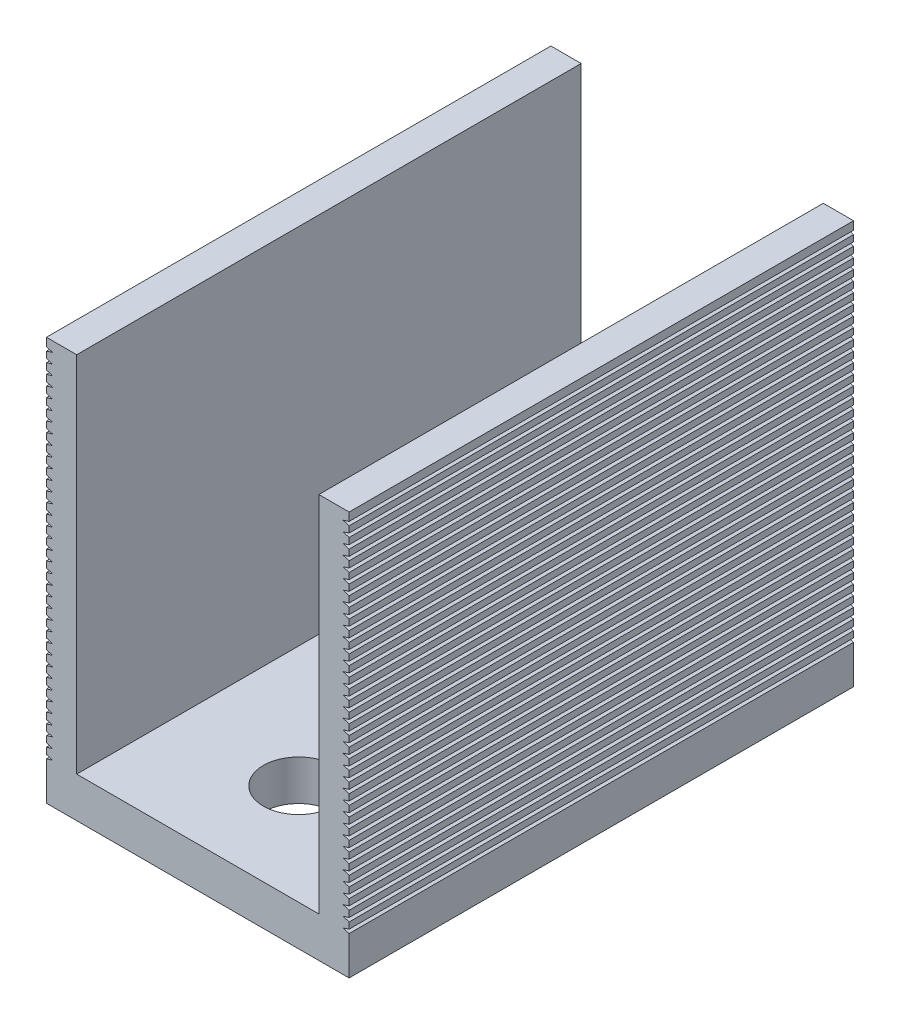
from build123d import *

# Parameters (mm, degrees)
BOSS_EXTRUDE1_DEPTH   = 25
SKETCH2_R             = 1.75
SKETCH2_W             = 12
SKETCH2_H             = 14.852283911
CUT_EXTRUDE1_DEPTH    = 25
CUT_EXTRUDE2_DEPTH    = 33.882366095
LPATTERN1_COUNT       = 36
LPATTERN1_PITCH       = 0.5
MIRROR1_COPY_1_DEPTH  = 33.882366095
MIRROR1_COPY_2_DEPTH  = 33.882366095
MIRROR1_COPY_3_DEPTH  = 33.882366095
MIRROR1_COPY_4_DEPTH  = 33.882366095
MIRROR1_COPY_5_DEPTH  = 33.882366095
MIRROR1_COPY_6_DEPTH  = 33.882366095
MIRROR1_COPY_7_DEPTH  = 33.882366095
MIRROR1_COPY_8_DEPTH  = 33.882366095
MIRROR1_COPY_9_DEPTH  = 33.882366095
MIRROR1_COPY_10_DEPTH = 33.882366095
MIRROR1_COPY_11_DEPTH = 33.882366095
MIRROR1_COPY_12_DEPTH = 33.882366095
MIRROR1_COPY_13_DEPTH = 33.882366095
MIRROR1_COPY_14_DEPTH = 33.882366095
MIRROR1_COPY_15_DEPTH = 33.882366095
MIRROR1_COPY_16_DEPTH = 33.882366095
MIRROR1_COPY_17_DEPTH = 33.882366095
MIRROR1_COPY_18_DEPTH = 33.882366095
MIRROR1_COPY_19_DEPTH = 33.882366095
MIRROR1_COPY_20_DEPTH = 33.882366095
MIRROR1_COPY_21_DEPTH = 33.882366095
MIRROR1_COPY_22_DEPTH = 33.882366095
MIRROR1_COPY_23_DEPTH = 33.882366095
MIRROR1_COPY_24_DEPTH = 33.882366095
MIRROR1_COPY_25_DEPTH = 33.882366095
MIRROR1_COPY_26_DEPTH = 33.882366095
MIRROR1_COPY_27_DEPTH = 33.882366095
MIRROR1_COPY_28_DEPTH = 33.882366095
MIRROR1_COPY_29_DEPTH = 33.882366095
MIRROR1_COPY_30_DEPTH = 33.882366095
MIRROR1_COPY_31_DEPTH = 33.882366095
MIRROR1_COPY_32_DEPTH = 33.882366095
MIRROR1_COPY_33_DEPTH = 33.882366095
MIRROR1_COPY_34_DEPTH = 33.882366095
MIRROR1_COPY_35_DEPTH = 33.882366095


with BuildPart() as part:
    # Sketch1 → Boss-Extrude1 (new body)
    with BuildSketch(Plane.XY):
        Polygon((-7.5, 20), (-7.5, 0), (7.5, 0), (7.5, 20), (6, 20), (6, 2), (-6, 2), (-6, 20), align=None)
    extrude(amount=BOSS_EXTRUDE1_DEPTH)

    # Sketch2 → Cut-Extrude1 (cut)
    with BuildSketch(Plane(origin=(0, 2, 0), x_dir=(1, 0, 0), z_dir=(0, 1, 0))):
        with Locations(Location((0, -20, 0), (0, 0, 180))):
            Circle(SKETCH2_R)
        with Locations((0, 1.426141956)):
            Rectangle(SKETCH2_W, SKETCH2_H)
    extrude(amount=-CUT_EXTRUDE1_DEPTH, mode=Mode.SUBTRACT)

    # Sketch3 → Cut-Extrude2 (cut, through all)
    with BuildSketch(Plane.XY.offset(25)):
        Polygon((-8, 19.75), (-7.2, 19.5), (-8, 19.25), align=None)
    cut_extrude2 = extrude(amount=-CUT_EXTRUDE2_DEPTH, mode=Mode.SUBTRACT)

    # LPattern1: Cut-Extrude2 ×36
    with Locations(*[(0, -i * LPATTERN1_PITCH, 0) for i in range(1, LPATTERN1_COUNT)]):
        add(cut_extrude2, mode=Mode.SUBTRACT)

    # Mirror1: Cut-Extrude2 across plane
    add(cut_extrude2.mirror(Plane(origin=(0, 0, 0), x_dir=(0, 0, 1), z_dir=(1, 0, 0))), mode=Mode.SUBTRACT)

    # Mirror1 copy 1 sketch → Mirror1 copy 1 (cut, through all)
    with BuildSketch(Plane(origin=(0, -0.5, 25), x_dir=(-1, 0, 0), z_dir=(0, 0, 1))):
        Polygon((-8, -19.75), (-7.2, -19.5), (-8, -19.25), align=None)
    extrude(amount=-MIRROR1_COPY_1_DEPTH, mode=Mode.SUBTRACT)

    # Mirror1 copy 2 sketch → Mirror1 copy 2 (cut, through all)
    with BuildSketch(Plane(origin=(0, -1, 25), x_dir=(-1, 0, 0), z_dir=(0, 0, 1))):
        Polygon((-8, -19.75), (-7.2, -19.5), (-8, -19.25), align=None)
    extrude(amount=-MIRROR1_COPY_2_DEPTH, mode=Mode.SUBTRACT)

    # Mirror1 copy 3 sketch → Mirror1 copy 3 (cut, through all)
    with BuildSketch(Plane(origin=(0, -1.5, 25), x_dir=(-1, 0, 0), z_dir=(0, 0, 1))):
        Polygon((-8, -19.75), (-7.2, -19.5), (-8, -19.25), align=None)
    extrude(amount=-MIRROR1_COPY_3_DEPTH, mode=Mode.SUBTRACT)

    # Mirror1 copy 4 sketch → Mirror1 copy 4 (cut, through all)
    with BuildSketch(Plane(origin=(0, -2, 25), x_dir=(-1, 0, 0), z_dir=(0, 0, 1))):
        Polygon((-8, -19.75), (-7.2, -19.5), (-8, -19.25), align=None)
    extrude(amount=-MIRROR1_COPY_4_DEPTH, mode=Mode.SUBTRACT)

    # Mirror1 copy 5 sketch → Mirror1 copy 5 (cut, through all)
    with BuildSketch(Plane(origin=(0, -2.5, 25), x_dir=(-1, 0, 0), z_dir=(0, 0, 1))):
        Polygon((-8, -19.75), (-7.2, -19.5), (-8, -19.25), align=None)
    extrude(amount=-MIRROR1_COPY_5_DEPTH, mode=Mode.SUBTRACT)

    # Mirror1 copy 6 sketch → Mirror1 copy 6 (cut, through all)
    with BuildSketch(Plane(origin=(0, -3, 25), x_dir=(-1, 0, 0), z_dir=(0, 0, 1))):
        Polygon((-8, -19.75), (-7.2, -19.5), (-8, -19.25), align=None)
    extrude(amount=-MIRROR1_COPY_6_DEPTH, mode=Mode.SUBTRACT)

    # Mirror1 copy 7 sketch → Mirror1 copy 7 (cut, through all)
    with BuildSketch(Plane(origin=(0, -3.5, 25), x_dir=(-1, 0, 0), z_dir=(0, 0, 1))):
        Polygon((-8, -19.75), (-7.2, -19.5), (-8, -19.25), align=None)
    extrude(amount=-MIRROR1_COPY_7_DEPTH, mode=Mode.SUBTRACT)

    # Mirror1 copy 8 sketch → Mirror1 copy 8 (cut, through all)
    with BuildSketch(Plane(origin=(0, -4, 25), x_dir=(-1, 0, 0), z_dir=(0, 0, 1))):
        Polygon((-8, -19.75), (-7.2, -19.5), (-8, -19.25), align=None)
    extrude(amount=-MIRROR1_COPY_8_DEPTH, mode=Mode.SUBTRACT)

    # Mirror1 copy 9 sketch → Mirror1 copy 9 (cut, through all)
    with BuildSketch(Plane(origin=(0, -4.5, 25), x_dir=(-1, 0, 0), z_dir=(0, 0, 1))):
        Polygon((-8, -19.75), (-7.2, -19.5), (-8, -19.25), align=None)
    extrude(amount=-MIRROR1_COPY_9_DEPTH, mode=Mode.SUBTRACT)

    # Mirror1 copy 10 sketch → Mirror1 copy 10 (cut, through all)
    with BuildSketch(Plane(origin=(0, -5, 25), x_dir=(-1, 0, 0), z_dir=(0, 0, 1))):
        Polygon((-8, -19.75), (-7.2, -19.5), (-8, -19.25), align=None)
    extrude(amount=-MIRROR1_COPY_10_DEPTH, mode=Mode.SUBTRACT)

    # Mirror1 copy 11 sketch → Mirror1 copy 11 (cut, through all)
    with BuildSketch(Plane(origin=(0, -5.5, 25), x_dir=(-1, 0, 0), z_dir=(0, 0, 1))):
        Polygon((-8, -19.75), (-7.2, -19.5), (-8, -19.25), align=None)
    extrude(amount=-MIRROR1_COPY_11_DEPTH, mode=Mode.SUBTRACT)

    # Mirror1 copy 12 sketch → Mirror1 copy 12 (cut, through all)
    with BuildSketch(Plane(origin=(0, -6, 25), x_dir=(-1, 0, 0), z_dir=(0, 0, 1))):
        Polygon((-8, -19.75), (-7.2, -19.5), (-8, -19.25), align=None)
    extrude(amount=-MIRROR1_COPY_12_DEPTH, mode=Mode.SUBTRACT)

    # Mirror1 copy 13 sketch → Mirror1 copy 13 (cut, through all)
    with BuildSketch(Plane(origin=(0, -6.5, 25), x_dir=(-1, 0, 0), z_dir=(0, 0, 1))):
        Polygon((-8, -19.75), (-7.2, -19.5), (-8, -19.25), align=None)
    extrude(amount=-MIRROR1_COPY_13_DEPTH, mode=Mode.SUBTRACT)

    # Mirror1 copy 14 sketch → Mirror1 copy 14 (cut, through all)
    with BuildSketch(Plane(origin=(0, -7, 25), x_dir=(-1, 0, 0), z_dir=(0, 0, 1))):
        Polygon((-8, -19.75), (-7.2, -19.5), (-8, -19.25), align=None)
    extrude(amount=-MIRROR1_COPY_14_DEPTH, mode=Mode.SUBTRACT)

    # Mirror1 copy 15 sketch → Mirror1 copy 15 (cut, through all)
    with BuildSketch(Plane(origin=(0, -7.5, 25), x_dir=(-1, 0, 0), z_dir=(0, 0, 1))):
        Polygon((-8, -19.75), (-7.2, -19.5), (-8, -19.25), align=None)
    extrude(amount=-MIRROR1_COPY_15_DEPTH, mode=Mode.SUBTRACT)

    # Mirror1 copy 16 sketch → Mirror1 copy 16 (cut, through all)
    with BuildSketch(Plane(origin=(0, -8, 25), x_dir=(-1, 0, 0), z_dir=(0, 0, 1))):
        Polygon((-8, -19.75), (-7.2, -19.5), (-8, -19.25), align=None)
    extrude(amount=-MIRROR1_COPY_16_DEPTH, mode=Mode.SUBTRACT)

    # Mirror1 copy 17 sketch → Mirror1 copy 17 (cut, through all)
    with BuildSketch(Plane(origin=(0, -8.5, 25), x_dir=(-1, 0, 0), z_dir=(0, 0, 1))):
        Polygon((-8, -19.75), (-7.2, -19.5), (-8, -19.25), align=None)
    extrude(amount=-MIRROR1_COPY_17_DEPTH, mode=Mode.SUBTRACT)

    # Mirror1 copy 18 sketch → Mirror1 copy 18 (cut, through all)
    with BuildSketch(Plane(origin=(0, -9, 25), x_dir=(-1, 0, 0), z_dir=(0, 0, 1))):
        Polygon((-8, -19.75), (-7.2, -19.5), (-8, -19.25), align=None)
    extrude(amount=-MIRROR1_COPY_18_DEPTH, mode=Mode.SUBTRACT)

    # Mirror1 copy 19 sketch → Mirror1 copy 19 (cut, through all)
    with BuildSketch(Plane(origin=(0, -9.5, 25), x_dir=(-1, 0, 0), z_dir=(0, 0, 1))):
        Polygon((-8, -19.75), (-7.2, -19.5), (-8, -19.25), align=None)
    extrude(amount=-MIRROR1_COPY_19_DEPTH, mode=Mode.SUBTRACT)

    # Mirror1 copy 20 sketch → Mirror1 copy 20 (cut, through all)
    with BuildSketch(Plane(origin=(0, -10, 25), x_dir=(-1, 0, 0), z_dir=(0, 0, 1))):
        Polygon((-8, -19.75), (-7.2, -19.5), (-8, -19.25), align=None)
    extrude(amount=-MIRROR1_COPY_20_DEPTH, mode=Mode.SUBTRACT)

    # Mirror1 copy 21 sketch → Mirror1 copy 21 (cut, through all)
    with BuildSketch(Plane(origin=(0, -10.5, 25), x_dir=(-1, 0, 0), z_dir=(0, 0, 1))):
        Polygon((-8, -19.75), (-7.2, -19.5), (-8, -19.25), align=None)
    extrude(amount=-MIRROR1_COPY_21_DEPTH, mode=Mode.SUBTRACT)

    # Mirror1 copy 22 sketch → Mirror1 copy 22 (cut, through all)
    with BuildSketch(Plane(origin=(0, -11, 25), x_dir=(-1, 0, 0), z_dir=(0, 0, 1))):
        Polygon((-8, -19.75), (-7.2, -19.5), (-8, -19.25), align=None)
    extrude(amount=-MIRROR1_COPY_22_DEPTH, mode=Mode.SUBTRACT)

    # Mirror1 copy 23 sketch → Mirror1 copy 23 (cut, through all)
    with BuildSketch(Plane(origin=(0, -11.5, 25), x_dir=(-1, 0, 0), z_dir=(0, 0, 1))):
        Polygon((-8, -19.75), (-7.2, -19.5), (-8, -19.25), align=None)
    extrude(amount=-MIRROR1_COPY_23_DEPTH, mode=Mode.SUBTRACT)

    # Mirror1 copy 24 sketch → Mirror1 copy 24 (cut, through all)
    with BuildSketch(Plane(origin=(0, -12, 25), x_dir=(-1, 0, 0), z_dir=(0, 0, 1))):
        Polygon((-8, -19.75), (-7.2, -19.5), (-8, -19.25), align=None)
    extrude(amount=-MIRROR1_COPY_24_DEPTH, mode=Mode.SUBTRACT)

    # Mirror1 copy 25 sketch → Mirror1 copy 25 (cut, through all)
    with BuildSketch(Plane(origin=(0, -12.5, 25), x_dir=(-1, 0, 0), z_dir=(0, 0, 1))):
        Polygon((-8, -19.75), (-7.2, -19.5), (-8, -19.25), align=None)
    extrude(amount=-MIRROR1_COPY_25_DEPTH, mode=Mode.SUBTRACT)

    # Mirror1 copy 26 sketch → Mirror1 copy 26 (cut, through all)
    with BuildSketch(Plane(origin=(0, -13, 25), x_dir=(-1, 0, 0), z_dir=(0, 0, 1))):
        Polygon((-8, -19.75), (-7.2, -19.5), (-8, -19.25), align=None)
    extrude(amount=-MIRROR1_COPY_26_DEPTH, mode=Mode.SUBTRACT)

    # Mirror1 copy 27 sketch → Mirror1 copy 27 (cut, through all)
    with BuildSketch(Plane(origin=(0, -13.5, 25), x_dir=(-1, 0, 0), z_dir=(0, 0, 1))):
        Polygon((-8, -19.75), (-7.2, -19.5), (-8, -19.25), align=None)
    extrude(amount=-MIRROR1_COPY_27_DEPTH, mode=Mode.SUBTRACT)

    # Mirror1 copy 28 sketch → Mirror1 copy 28 (cut, through all)
    with BuildSketch(Plane(origin=(0, -14, 25), x_dir=(-1, 0, 0), z_dir=(0, 0, 1))):
        Polygon((-8, -19.75), (-7.2, -19.5), (-8, -19.25), align=None)
    extrude(amount=-MIRROR1_COPY_28_DEPTH, mode=Mode.SUBTRACT)

    # Mirror1 copy 29 sketch → Mirror1 copy 29 (cut, through all)
    with BuildSketch(Plane(origin=(0, -14.5, 25), x_dir=(-1, 0, 0), z_dir=(0, 0, 1))):
        Polygon((-8, -19.75), (-7.2, -19.5), (-8, -19.25), align=None)
    extrude(amount=-MIRROR1_COPY_29_DEPTH, mode=Mode.SUBTRACT)

    # Mirror1 copy 30 sketch → Mirror1 copy 30 (cut, through all)
    with BuildSketch(Plane(origin=(0, -15, 25), x_dir=(-1, 0, 0), z_dir=(0, 0, 1))):
        Polygon((-8, -19.75), (-7.2, -19.5), (-8, -19.25), align=None)
    extrude(amount=-MIRROR1_COPY_30_DEPTH, mode=Mode.SUBTRACT)

    # Mirror1 copy 31 sketch → Mirror1 copy 31 (cut, through all)
    with BuildSketch(Plane(origin=(0, -15.5, 25), x_dir=(-1, 0, 0), z_dir=(0, 0, 1))):
        Polygon((-8, -19.75), (-7.2, -19.5), (-8, -19.25), align=None)
    extrude(amount=-MIRROR1_COPY_31_DEPTH, mode=Mode.SUBTRACT)

    # Mirror1 copy 32 sketch → Mirror1 copy 32 (cut, through all)
    with BuildSketch(Plane(origin=(0, -16, 25), x_dir=(-1, 0, 0), z_dir=(0, 0, 1))):
        Polygon((-8, -19.75), (-7.2, -19.5), (-8, -19.25), align=None)
    extrude(amount=-MIRROR1_COPY_32_DEPTH, mode=Mode.SUBTRACT)

    # Mirror1 copy 33 sketch → Mirror1 copy 33 (cut, through all)
    with BuildSketch(Plane(origin=(0, -16.5, 25), x_dir=(-1, 0, 0), z_dir=(0, 0, 1))):
        Polygon((-8, -19.75), (-7.2, -19.5), (-8, -19.25), align=None)
    extrude(amount=-MIRROR1_COPY_33_DEPTH, mode=Mode.SUBTRACT)

    # Mirror1 copy 34 sketch → Mirror1 copy 34 (cut, through all)
    with BuildSketch(Plane(origin=(0, -17, 25), x_dir=(-1, 0, 0), z_dir=(0, 0, 1))):
        Polygon((-8, -19.75), (-7.2, -19.5), (-8, -19.25), align=None)
    extrude(amount=-MIRROR1_COPY_34_DEPTH, mode=Mode.SUBTRACT)

    # Mirror1 copy 35 sketch → Mirror1 copy 35 (cut, through all)
    with BuildSketch(Plane(origin=(0, -17.5, 25), x_dir=(-1, 0, 0), z_dir=(0, 0, 1))):
        Polygon((-8, -19.75), (-7.2, -19.5), (-8, -19.25), align=None)
    extrude(amount=-MIRROR1_COPY_35_DEPTH, mode=Mode.SUBTRACT)


solid = part.part
